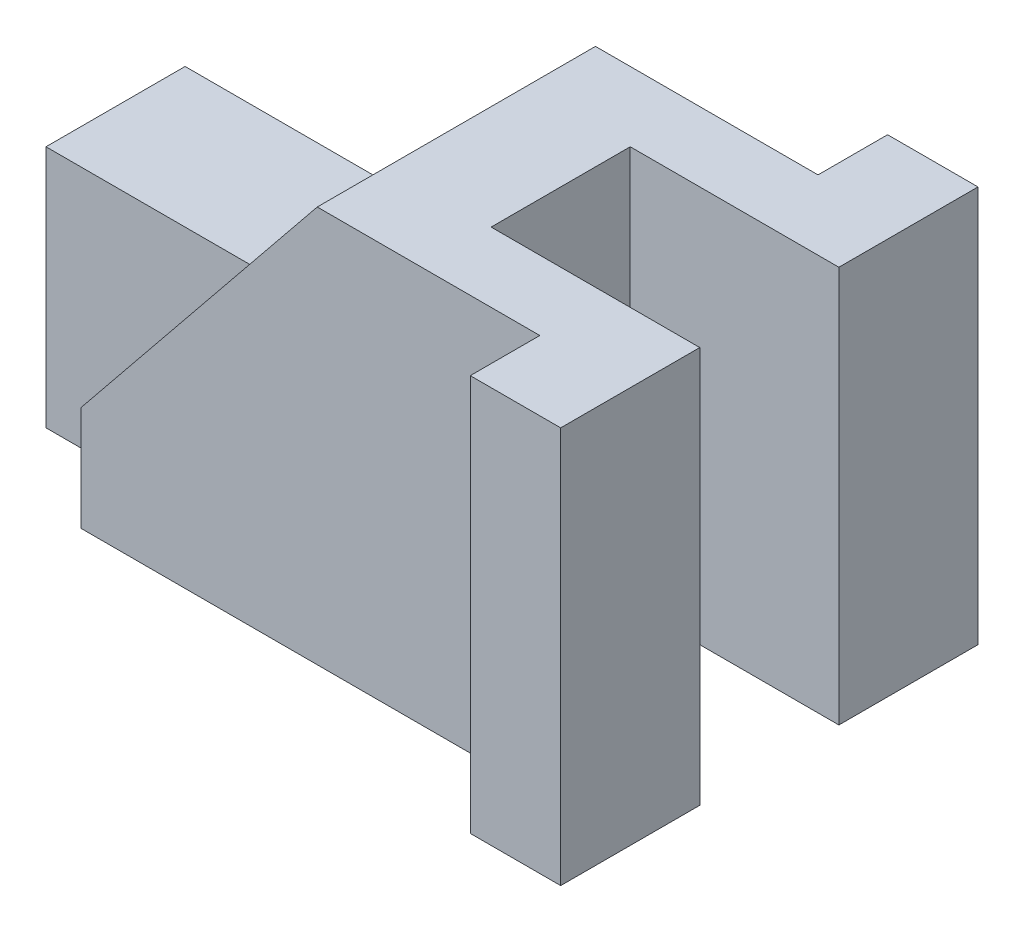
from build123d import *

# Parameters (mm, degrees)
BOSS_EXTRUDE1_DEPTH = 20
SKETCH2_W           = 13
SKETCH2_H           = 57
BOSS_EXTRUDE2_DEPTH = 30
SKETCH3_W           = 30
SKETCH3_H           = 20
CUT_EXTRUDE1_DEPTH  = 102.931349447
BOSS_EXTRUDE3_REACH = 118.931
BOSS_EXTRUDE3_START = -15
SKETCH5_W           = 20
SKETCH5_H           = 35


with BuildPart() as part:
    # Sketch1 → Boss-Extrude1 (new, symmetric)
    with BuildSketch(Plane.XY):
        Polygon((0, 0), (66, 0), (66, 57), (34, 57), (0, 15), align=None)
    extrude(amount=BOSS_EXTRUDE1_DEPTH, both=True)

    # Sketch2 → Boss-Extrude2 (add, symmetric)
    with BuildSketch(Plane.XY):
        with Locations((72.5, 28.5)):
            Rectangle(SKETCH2_W, SKETCH2_H)
    extrude(amount=BOSS_EXTRUDE2_DEPTH, both=True)

    # Sketch3 → Cut-Extrude1 (cut, through all)
    with BuildSketch(Plane(origin=(0, 0, 0), x_dir=(1, 0, 0), z_dir=(0, 1, 0))):
        with Locations((64, 0)):
            Rectangle(SKETCH3_W, SKETCH3_H)
    extrude(amount=CUT_EXTRUDE1_DEPTH, mode=Mode.SUBTRACT)

    # Sketch5 → Boss-Extrude3 (add, up to next)
    with BuildSketch(Plane(origin=(0, 0, 0), x_dir=(0, 0, -1), z_dir=(1, 0, 0)).offset(BOSS_EXTRUDE3_START), mode=Mode.PRIVATE) as boss_extrude3_sk1:
        with Locations((0, 17.5)):
            Rectangle(SKETCH5_W, SKETCH5_H)
    boss_extrude3_tool1 = extrude(boss_extrude3_sk1.sketch, amount=BOSS_EXTRUDE3_REACH, mode=Mode.PRIVATE) - part.part
    add(boss_extrude3_tool1.solids().sort_by_distance((-15, 17.5, 0))[0])


solid = part.part
